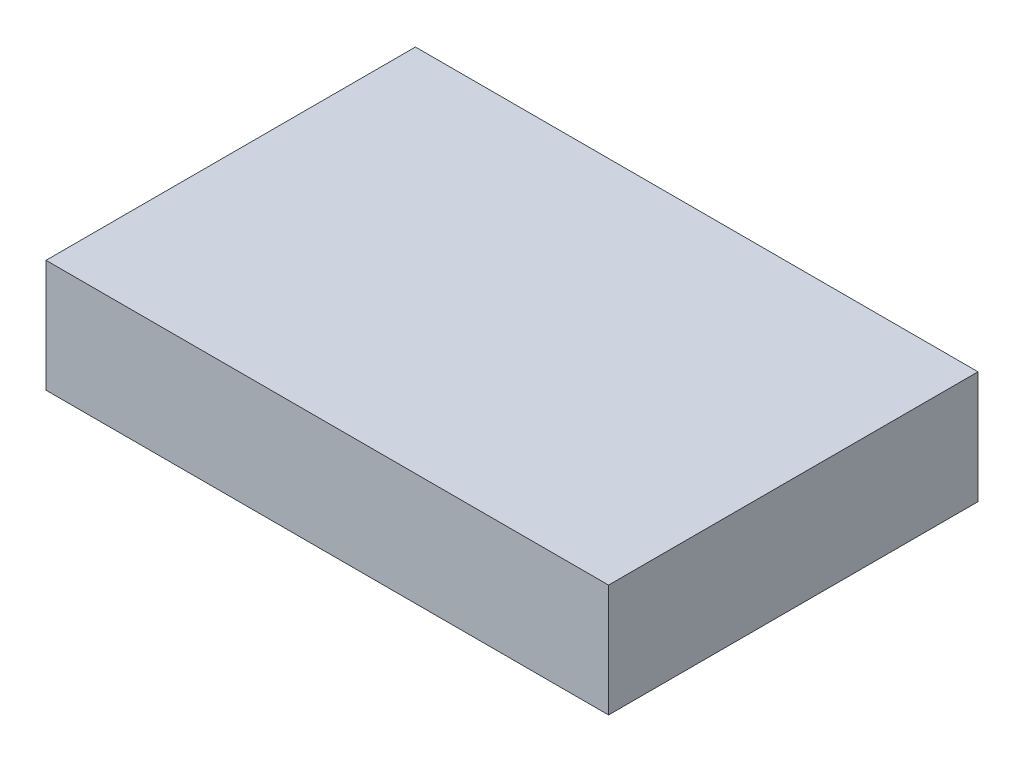
from build123d import *

# Parameters (mm, degrees)
SKETCH1_W           = 85.09
SKETCH1_H           = 55.88
BOSS_EXTRUDE1_DEPTH = 17.018


with BuildPart() as part:
    # Sketch1 → Boss-Extrude1 (new body)
    with BuildSketch(Plane(origin=(0, 0, 0), x_dir=(1, 0, 0), z_dir=(0, 1, 0))):
        with Locations((42.545, 27.94)):
            Rectangle(SKETCH1_W, SKETCH1_H)
    extrude(amount=BOSS_EXTRUDE1_DEPTH)


solid = part.part
